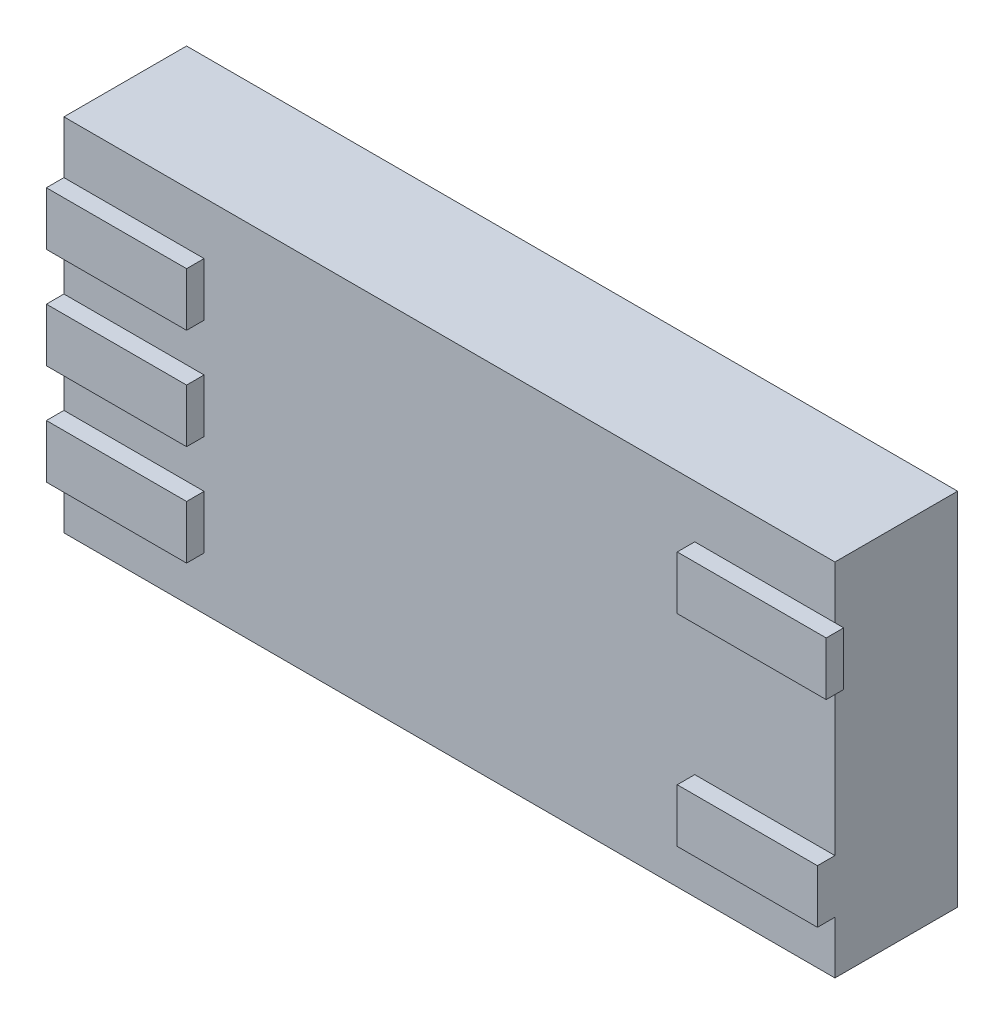
from build123d import *

# Parameters (mm, degrees)
SKETCH1_W           = 55.88
SKETCH1_H           = 26.1112
BOSS_EXTRUDE1_DEPTH = 8.89
SKETCH2_W           = 10.16
SKETCH2_H           = 3.869870213
SKETCH2_H_2         = 3.869870212
BOSS_EXTRUDE2_DEPTH = 1.27
SKETCH3_W           = 1.27
SKETCH3_H           = 3.869870213
BOSS_EXTRUDE3_DEPTH = 0.635


with BuildPart() as part:
    # Sketch1 → Boss-Extrude1 (new body)
    with BuildSketch(Plane.XY):
        with Locations((27.94, 13.0556)):
            Rectangle(SKETCH1_W, SKETCH1_H)
    extrude(amount=BOSS_EXTRUDE1_DEPTH)

    # Sketch2 → Boss-Extrude2 (add)
    with BuildSketch(Plane.XY.offset(8.89)):
        with Locations((5.08, 5.750232763)):
            Rectangle(SKETCH2_W, SKETCH2_H)
        with Locations((5.08, 13.0556)):
            Rectangle(SKETCH2_W, SKETCH2_H_2)
        with Locations((5.08, 20.360967237)):
            Rectangle(SKETCH2_W, SKETCH2_H)
        with Locations((50.8, 5.750232763)):
            Rectangle(SKETCH2_W, SKETCH2_H)
        with Locations((50.8, 20.360967237)):
            Rectangle(SKETCH2_W, SKETCH2_H)
    extrude(amount=BOSS_EXTRUDE2_DEPTH)

    # Sketch3 → Boss-Extrude3 (add)
    with BuildSketch(Plane(origin=(55.88, 0, 0), x_dir=(0, 0, -1), z_dir=(1, 0, 0))):
        with Locations((-9.525, 20.360967237)):
            Rectangle(SKETCH3_W, SKETCH3_H)
    extrude(amount=BOSS_EXTRUDE3_DEPTH)


solid = part.part
